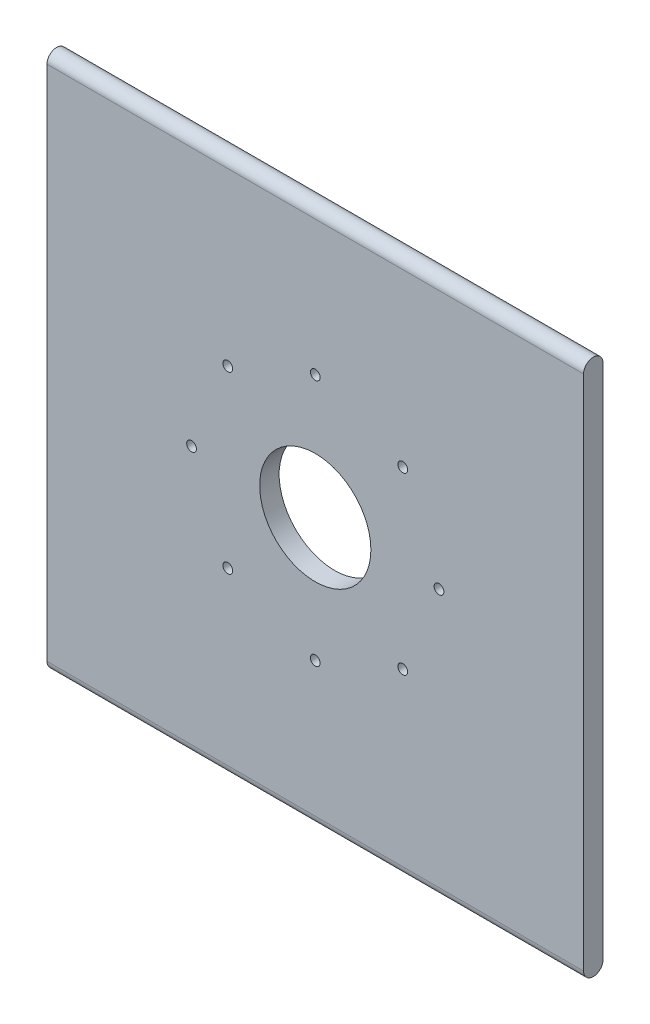
from build123d import *

# Parameters (mm, degrees)
SKETCH_1_W          = 193
SKETCH_1_H          = 193
EXTRUDE_1_DEPTH     = 7
SKETCH_2_R          = 20
CUT_EXTRUDE_1_DEPTH = 123
SKETCH_3_R          = 1.75
CUT_EXTRUDE_2_DEPTH = 137.651015364
FILLET_2_RADIUS     = 3.5
FILLET_2_LENGTH     = 193
FILLET_4_RADIUS     = 3.5
FILLET_4_LENGTH     = 193


with BuildPart() as part:
    # 草图1 → 凸台-拉伸1 (new body)
    with BuildSketch(Plane.XY):
        Rectangle(SKETCH_1_W, SKETCH_1_H)
    extrude(amount=EXTRUDE_1_DEPTH)

    # 草图2 → 切除-拉伸1 (cut)
    with BuildSketch(Plane.XY.offset(7)):
        Circle(SKETCH_2_R)
    extrude(amount=-CUT_EXTRUDE_1_DEPTH, mode=Mode.SUBTRACT)

    # 草图3 → 切除-拉伸2 (cut, through all)
    with BuildSketch(Plane.XY.offset(7)):
        with Locations((0, 44.5)):
            Circle(SKETCH_3_R)
        with Locations((31.466251763, 31.466251763)):
            Circle(SKETCH_3_R)
        with Locations((44.5, 0)):
            Circle(SKETCH_3_R)
        with Locations((31.466251763, -31.466251763)):
            Circle(SKETCH_3_R)
        with Locations((0, -44.5)):
            Circle(SKETCH_3_R)
        with Locations((-31.466251763, -31.466251763)):
            Circle(SKETCH_3_R)
        with Locations((-44.5, 0)):
            Circle(SKETCH_3_R)
        with Locations((-31.466251763, 31.466251763)):
            Circle(SKETCH_3_R)
    extrude(amount=-CUT_EXTRUDE_2_DEPTH, mode=Mode.SUBTRACT)

    # 圆角2: full round fillet: the end face becomes a half cylinder, R = half its width
    fillet_2_face = Plane((0, 96.5, 3.5), x_dir=(-1, 0, 0), z_dir=(0, 1, 0))  # on the end face: x along it, z out of the body
    fillet_2_slab = fillet_2_face.offset(-FILLET_2_RADIUS / 2) * Box(FILLET_2_LENGTH, 2 * FILLET_2_RADIUS, FILLET_2_RADIUS, mode=Mode.PRIVATE)  # the body's end, R deep
    fillet_2_round = Plane((0, 93, 3.5), x_dir=(0, 1, 0), z_dir=(-1, 0, 0)) * Cylinder(FILLET_2_RADIUS, FILLET_2_LENGTH, mode=Mode.PRIVATE)  # its axis R under the face
    add(fillet_2_slab - fillet_2_round, mode=Mode.SUBTRACT)

    # 圆角4: full round fillet: the end face becomes a half cylinder, R = half its width
    fillet_4_face = Plane((0, -96.5, 3.5), x_dir=(-1, 0, 0), z_dir=(0, -1, 0))  # on the end face: x along it, z out of the body
    fillet_4_slab = fillet_4_face.offset(-FILLET_4_RADIUS / 2) * Box(FILLET_4_LENGTH, 2 * FILLET_4_RADIUS, FILLET_4_RADIUS, mode=Mode.PRIVATE)  # the body's end, R deep
    fillet_4_round = Plane((0, -93, 3.5), x_dir=(0, -1, 0), z_dir=(-1, 0, 0)) * Cylinder(FILLET_4_RADIUS, FILLET_4_LENGTH, mode=Mode.PRIVATE)  # its axis R under the face
    add(fillet_4_slab - fillet_4_round, mode=Mode.SUBTRACT)


solid = part.part
